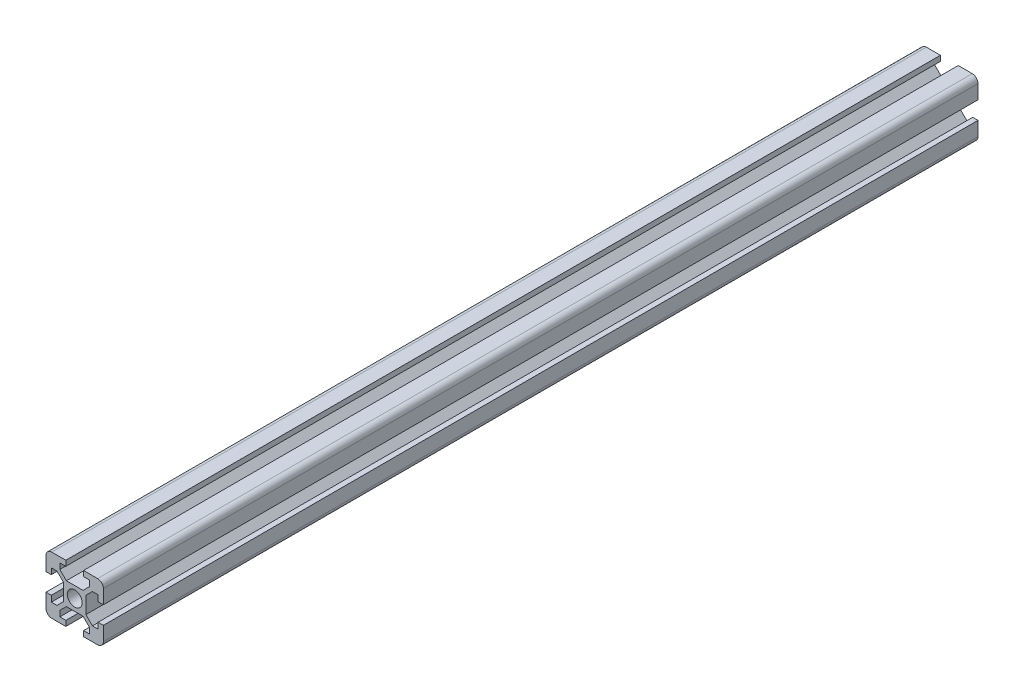
from build123d import *

# Parameters (mm, degrees)
SKETCH1_R           = 2.6
BOSS_EXTRUDE1_DEPTH = 304.8
FILLET1_R           = 2


with BuildPart() as part:
    # Sketch1 → Boss-Extrude1 (new body)
    with BuildSketch(Plane.XY):
        Polygon((-3.9, 2.910050506), (-6.179949494, 5.19), (-8.15, 5.19), (-8.15, 3.1), (-10, 3.1), (-10, 10), (-3.1, 10), (-3.1, 8.15), (-5.19, 8.15), (-5.19, 6.179949494), (-2.910050506, 3.9), (2.910050506, 3.9), (5.19, 6.179949494), (5.19, 8.15), (3.1, 8.15), (3.1, 10), (10, 10), (10, 3.1), (8.15, 3.1), (8.15, 5.19), (6.179949494, 5.19), (3.9, 2.910050506), (3.9, -2.910050506), (6.179949494, -5.19), (8.15, -5.19), (8.15, -3.1), (10, -3.1), (10, -10), (3.1, -10), (3.1, -8.15), (5.19, -8.15), (5.19, -6.179949494), (2.910050506, -3.9), (-2.910050506, -3.9), (-5.19, -6.179949494), (-5.19, -8.15), (-3.1, -8.15), (-3.1, -10), (-10, -10), (-10, -3.1), (-8.15, -3.1), (-8.15, -5.19), (-6.179949494, -5.19), (-3.9, -2.910050506), align=None)
        Circle(SKETCH1_R, mode=Mode.SUBTRACT)
    extrude(amount=-BOSS_EXTRUDE1_DEPTH)

    # Fillet1
    fillet1_edges = [part.edges().sort_by_distance(p)[0] for p in [
        (-10, 10, -152.4),
        (10, 10, -152.4),
        (10, -10, -152.4),
        (-10, -10, -152.4),
    ]]
    fillet(fillet1_edges, radius=FILLET1_R)


solid = part.part
